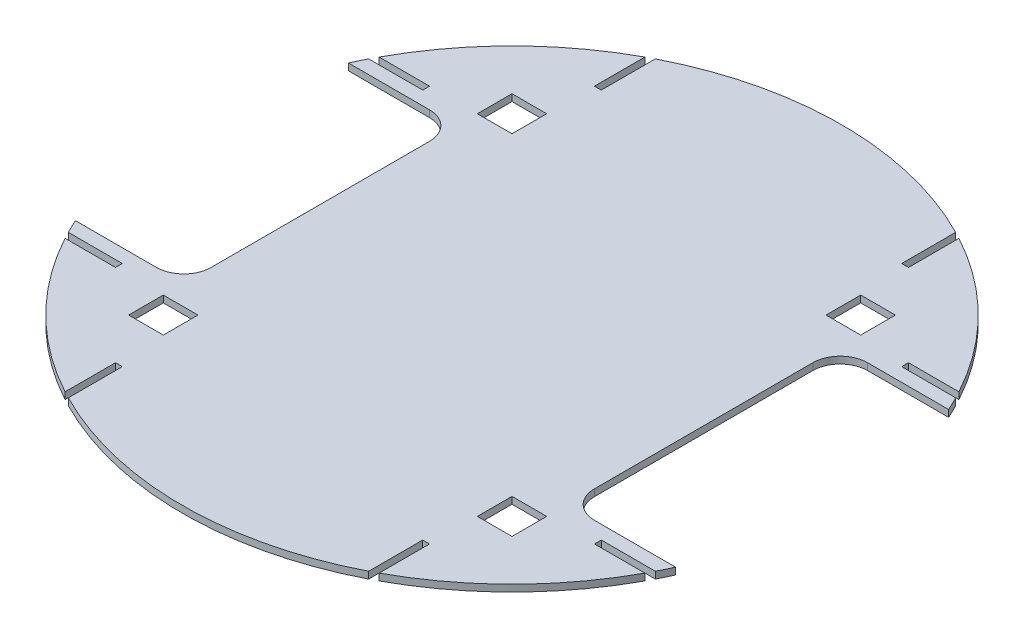
from build123d import *

# Parameters (mm, degrees)
SKETCH1_W           = 25.4
SKETCH1_H           = 25.4
BOSS_EXTRUDE1_DEPTH = 5


with BuildPart() as part:
    # Sketch1 → Boss-Extrude1 (new body)
    with BuildSketch(Plane(origin=(0, 0, 0), x_dir=(1, 0, 0), z_dir=(0, 1, 0))):
        with BuildLine():
            Line((-219.790265708, 100), (-160.4, 100))
            ThreePointArc((-160.4, 100), (-146.257864376, 94.142135624), (-140.4, 80))
            Line((-140.4, 80), (-140.4, -80))
            ThreePointArc((-140.4, -80), (-146.257864376, -94.142135624), (-160.4, -100))
            Line((-160.4, -100), (-219.790265708, -100))
            ThreePointArc((-219.790265708, -100), (-217.432582206, -105.027772971), (-214.959905331, -110))
            Line((-214.959905331, -110), (-175.4, -110))
            Line((-175.4, -110), (-175.4, -115))
            Line((-175.4, -115), (-212.327014061, -115))
            ThreePointArc((-212.327014061, -115), (-170.745074453, -170.745074453), (-115, -212.327014061))
            Line((-115, -212.327014061), (-115, -175.4))
            Line((-115, -175.4), (-110, -175.4))
            Line((-110, -175.4), (-110, -214.959905331))
            ThreePointArc((-110, -214.959905331), (0, -241.47), (110, -214.959905331))
            Line((110, -214.959905331), (110, -175.4))
            Line((110, -175.4), (115, -175.4))
            Line((115, -175.4), (115, -212.327014061))
            ThreePointArc((115, -212.327014061), (170.745074453, -170.745074453), (212.327014061, -115))
            Line((212.327014061, -115), (175.4, -115))
            Line((175.4, -115), (175.4, -110))
            Line((175.4, -110), (214.959905331, -110))
            ThreePointArc((214.959905331, -110), (217.432582206, -105.027772971), (219.790265708, -100))
            Line((219.790265708, -100), (160.4, -100))
            ThreePointArc((160.4, -100), (146.257864376, -94.142135624), (140.4, -80))
            Line((140.4, -80), (140.4, 80))
            ThreePointArc((140.4, 80), (146.257864376, 94.142135624), (160.4, 100))
            Line((160.4, 100), (219.790265708, 100))
            ThreePointArc((219.790265708, 100), (217.432582206, 105.027772971), (214.959905331, 110))
            Line((214.959905331, 110), (175.4, 110))
            Line((175.4, 110), (175.4, 115))
            Line((175.4, 115), (212.327014061, 115))
            ThreePointArc((212.327014061, 115), (170.745074453, 170.745074453), (115, 212.327014061))
            Line((115, 212.327014061), (115, 175.4))
            Line((115, 175.4), (110, 175.4))
            Line((110, 175.4), (110, 214.959905331))
            ThreePointArc((110, 214.959905331), (0, 241.47), (-110, 214.959905331))
            Line((-110, 214.959905331), (-110, 175.4))
            Line((-110, 175.4), (-115, 175.4))
            Line((-115, 175.4), (-115, 212.327014061))
            ThreePointArc((-115, 212.327014061), (-170.745074453, 170.745074453), (-212.327014061, 115))
            Line((-212.327014061, 115), (-175.4, 115))
            Line((-175.4, 115), (-175.4, 110))
            Line((-175.4, 110), (-214.959905331, 110))
            ThreePointArc((-214.959905331, 110), (-217.432582206, 105.027772971), (-219.790265708, 100))
        make_face()
        with Locations((127.7, 127.7)):
            Rectangle(SKETCH1_W, SKETCH1_H, mode=Mode.SUBTRACT)
        with Locations((-127.7, 127.7)):
            Rectangle(SKETCH1_W, SKETCH1_H, mode=Mode.SUBTRACT)
        with Locations((127.7, -127.7)):
            Rectangle(SKETCH1_W, SKETCH1_H, mode=Mode.SUBTRACT)
        with Locations((-127.7, -127.7)):
            Rectangle(SKETCH1_W, SKETCH1_H, mode=Mode.SUBTRACT)
    extrude(amount=BOSS_EXTRUDE1_DEPTH)


solid = part.part
